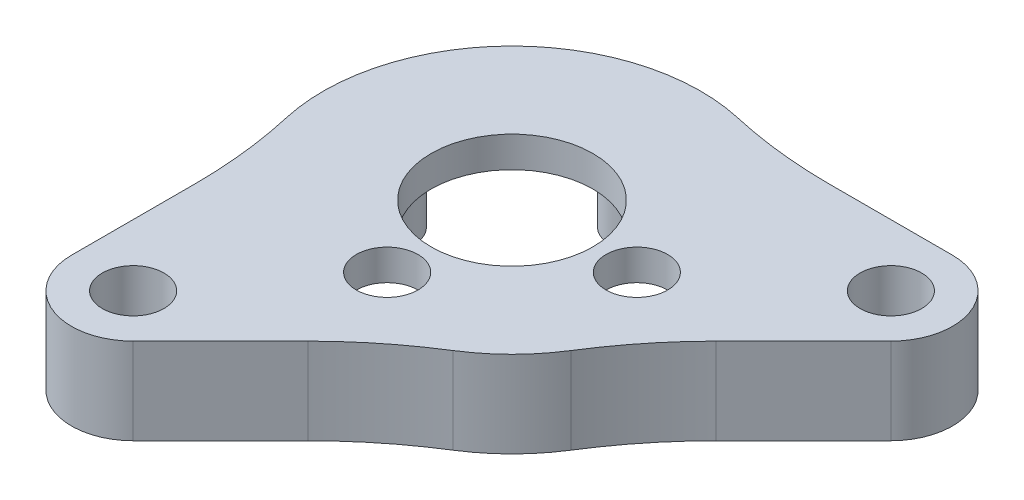
from build123d import *

# Parameters (mm, degrees)
BOSS_EXTRUDE7_DEPTH = 3.6
SKETCH3_R           = 11.2
SKETCH3_R_2         = 5.25
BOSS_EXTRUDE8_DEPTH = 2
SKETCH4_R           = 2
CUT_EXTRUDE1_DEPTH  = 31.753353097
FILLET5_R           = 30
SKETCH5_R           = 1.8
BOSS_EXTRUDE9_DEPTH = 3.6
SKETCH6_R           = 2
CUT_EXTRUDE3_DEPTH  = 10


with BuildPart() as part:
    # Sketch1 → Boss-Extrude7 (new body)
    with BuildSketch(Plane(origin=(0, 0, 0), x_dir=(1, 0, 0), z_dir=(0, 1, 0))):
        with BuildLine():
            ThreePointArc((4.41085686, -11.428335039), (-4.687872046, -11.317524273), (-11.2, -4.962106408))
            Line((-11.2, -4.962106408), (-11.2, -17.382337649))
            ThreePointArc((-11.2, -17.382337649), (-8.730733729, -21.077855779), (-4.371572875, -20.210764774))
            Line((-4.371572875, -20.210764774), (4.41085686, -11.428335039))
        make_face()
        with BuildLine():
            ThreePointArc((7.91959592, -7.919595979), (-4.286054462, -10.347450756), (-11.2, 0))
            Line((-11.2, 0), (-11.2, -4.962106408))
            ThreePointArc((-11.2, -4.962106408), (-4.687872046, -11.317524273), (4.41085686, -11.428335039))
            Line((4.41085686, -11.428335039), (7.91959592, -7.919595979))
        make_face()
        with BuildLine():
            Line((11.428335039, -4.41085686), (7.91959592, -7.919595979))
            Line((7.91959592, -7.919595979), (4.41085686, -11.428335039))
            ThreePointArc((4.41085686, -11.428335039), (8.66205807, -8.66205807), (11.428335039, -4.41085686))
        make_face()
        with BuildLine():
            Line((4.962106408, 11.2), (0, 11.2))
            ThreePointArc((0, 11.2), (7.919595949, 7.919595949), (11.2, 0))
            ThreePointArc((11.2, 0), (10.347450756, -4.286054462), (7.91959592, -7.919595979))
            Line((7.91959592, -7.919595979), (11.428335039, -4.41085686))
            ThreePointArc((11.428335039, -4.41085686), (12.042831981, -2.243367532), (12.25, 0))
            ThreePointArc((12.25, 0), (10.267626393, 6.681193625), (4.962106408, 11.2))
        make_face()
        with BuildLine():
            Line((17.382337649, 11.2), (4.962106408, 11.2))
            ThreePointArc((4.962106408, 11.2), (10.267626393, 6.681193625), (12.25, 0))
            ThreePointArc((12.25, 0), (12.042831981, -2.243367532), (11.428335039, -4.41085686))
            Line((11.428335039, -4.41085686), (20.210764774, 4.371572875))
            ThreePointArc((20.210764774, 4.371572875), (21.077855779, 8.730733729), (17.382337649, 11.2))
        make_face()
        with BuildLine():
            ThreePointArc((-11.2, 0), (-7.919595949, 7.919595949), (0, 11.2))
            Line((0, 11.2), (4.962106408, 11.2))
            ThreePointArc((4.962106408, 11.2), (-8.66205807, 8.66205807), (-11.2, -4.962106408))
            Line((-11.2, -4.962106408), (-11.2, 0))
        make_face()
    extrude(amount=BOSS_EXTRUDE7_DEPTH)

    # Sketch3 → Boss-Extrude8 (add)
    # profile 1 of 2: a face of its own
    with BuildSketch(Plane(origin=(0, 3.6, 0), x_dir=(1, 0, 0), z_dir=(0, 1, 0))):
        with BuildLine():
            Line((-4.371572875, -20.210764774), (4.41085686, -11.428335039))
            ThreePointArc((4.41085686, -11.428335039), (8.66205807, -8.66205807), (11.428335039, -4.41085686))
            Line((11.428335039, -4.41085686), (20.210764774, 4.371572875))
            ThreePointArc((20.210764774, 4.371572875), (21.077855779, 8.730733729), (17.382337649, 11.2))
            Line((17.382337649, 11.2), (4.962106408, 11.2))
            ThreePointArc((4.962106408, 11.2), (-8.66205807, 8.66205807), (-11.2, -4.962106408))
            Line((-11.2, -4.962106408), (-11.2, -17.382337649))
            ThreePointArc((-11.2, -17.382337649), (-8.730733729, -21.077855779), (-4.371572875, -20.210764774))
        make_face()
        with Locations(Location((0, 0, 0), (0, 0, 270))):
            Circle(SKETCH3_R, mode=Mode.SUBTRACT)
    # profile 2 of 2: a face of its own
    with BuildSketch(Plane(origin=(0, 3.6, 0), x_dir=(1, 0, 0), z_dir=(0, 1, 0))):
        with Locations(Location((0, 0, 0), (0, 0, 270))):
            Circle(SKETCH3_R)
        with Locations(Location((0, 0, 0), (0, 0, 270))):
            Circle(SKETCH3_R_2, mode=Mode.SUBTRACT)
    extrude(amount=BOSS_EXTRUDE8_DEPTH)

    # Sketch4 → Cut-Extrude1 (cut, through all)
    with BuildSketch(Plane(origin=(0, 0, 0), x_dir=(1, 0, 0), z_dir=(0, 1, 0))):
        with Locations(Location((-7.2, -17.382337649, 0), (0, 0, 270))):
            Circle(SKETCH4_R)
        with Locations(Location((17.382337649, 7.2, 0), (0, 0, 270))):
            Circle(SKETCH4_R)
    extrude(amount=CUT_EXTRUDE1_DEPTH, mode=Mode.SUBTRACT)

    # Fillet5
    fillet5_edges = [part.edges().sort_by_distance(p)[0] for p in [
        (4.41085686, 2.8, 11.428335039),
        (-11.2, 2.8, 4.962106408),
        (4.962106408, 2.8, -11.2),
        (11.428335039, 2.8, 4.41085686),
    ]]
    fillet(fillet5_edges, radius=FILLET5_R)

    # Sketch5 → Boss-Extrude9 (add)
    with BuildSketch(Plane.XZ.offset(-3.6)):
        with Locations(Location((-8.1, 0, 0), (0, 0, 90))):
            Circle(SKETCH5_R)
        with Locations(Location((8.1, 0, 0), (0, 0, 90))):
            Circle(SKETCH5_R)
        with Locations(Location((0, -8.1, 0), (0, 0, 90))):
            Circle(SKETCH5_R)
        with Locations(Location((0, 8.1, 0), (0, 0, 90))):
            Circle(SKETCH5_R)
    extrude(amount=BOSS_EXTRUDE9_DEPTH)

    # Sketch6 → Cut-Extrude3 (cut)
    with BuildSketch(Plane.XZ):
        with Locations(Location((0, 8.1, 0), (0, 0, 90))):
            Circle(SKETCH6_R)
    cut_extrude3 = extrude(amount=-CUT_EXTRUDE3_DEPTH, mode=Mode.SUBTRACT)

    # Mirror1: Cut-Extrude3 across plane
    add(cut_extrude3.mirror(Plane(origin=(0, 0, 0), x_dir=(0.707106781186546, 0, 0.707106781186549), z_dir=(-0.707106781186549, 0, 0.707106781186546))), mode=Mode.SUBTRACT)


solid = part.part
